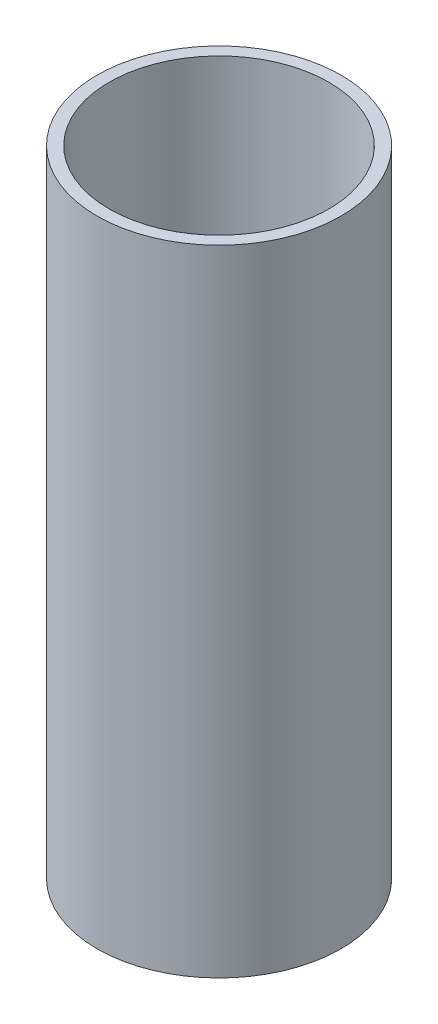
from build123d import *

# Parameters (mm, degrees)
SKETCH1_R           = 25
SKETCH1_R_2         = 22.5
BOSS_EXTRUDE2_DEPTH = 130


with BuildPart() as part:
    # Sketch1 → Boss-Extrude2 (new body)
    with BuildSketch(Plane(origin=(0, 0, 0), x_dir=(1, 0, 0), z_dir=(0, 1, 0))):
        with Locations(Location((0, 0, 0), (0, 0, 270))):
            Circle(SKETCH1_R)
        with Locations(Location((0, 0, 0), (0, 0, 270))):
            Circle(SKETCH1_R_2, mode=Mode.SUBTRACT)
    extrude(amount=BOSS_EXTRUDE2_DEPTH)


solid = part.part
